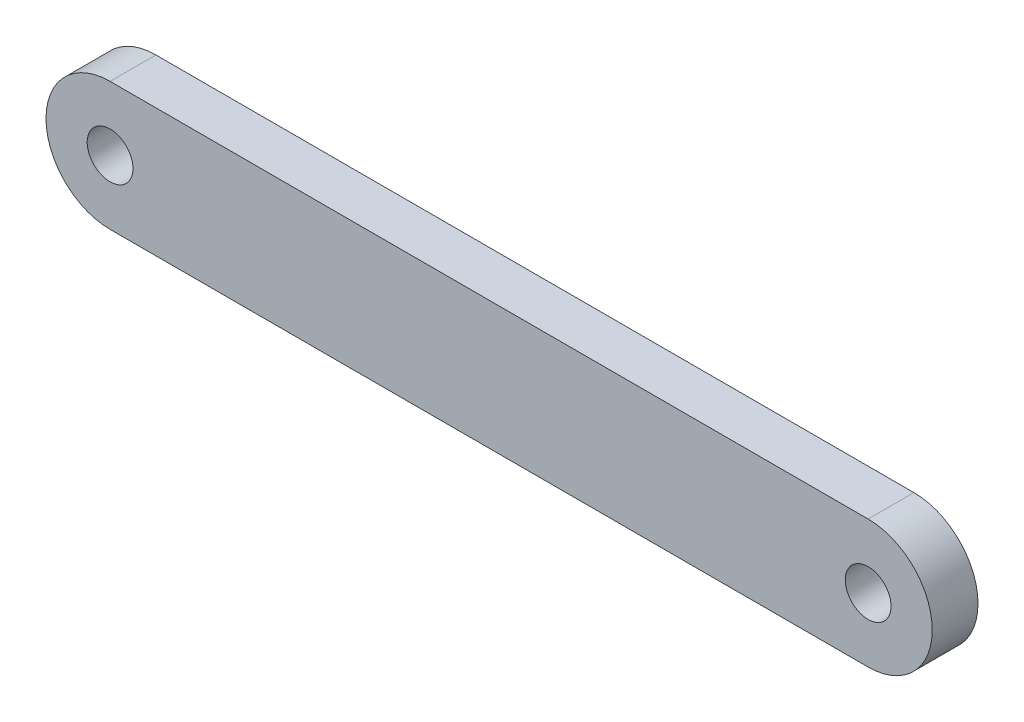
from build123d import *

# Parameters (mm, degrees)
SKETCH1_R           = 3.175
BOSS_EXTRUDE1_DEPTH = 6.35


with BuildPart() as part:
    # Sketch1 → Boss-Extrude1 (new body)
    with BuildSketch(Plane.XY):
        with BuildLine():
            Line((-49.911, -8.773302225), (55.232, -8.773302225))
            ThreePointArc((55.232, -8.773302225), (64.122, 0.116697775), (55.232, 9.006697775))
            Line((55.232, 9.006697775), (-49.911, 9.006697775))
            ThreePointArc((-49.911, 9.006697775), (-58.801, 0.116697775), (-49.911, -8.773302225))
        make_face()
        with Locations((-49.911, 0.116697775)):
            Circle(SKETCH1_R, mode=Mode.SUBTRACT)
        with Locations((55.232, 0.116697775)):
            Circle(SKETCH1_R, mode=Mode.SUBTRACT)
    extrude(amount=BOSS_EXTRUDE1_DEPTH)


solid = part.part
